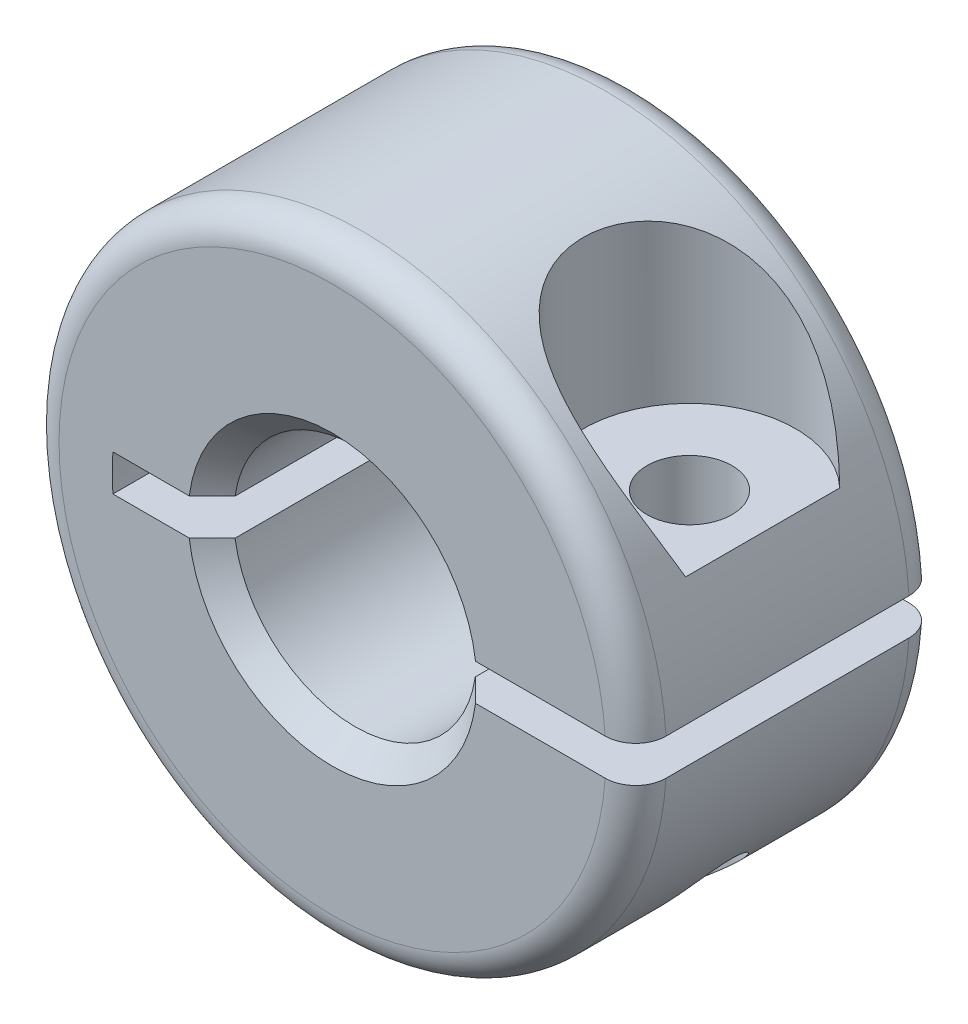
from build123d import *

# Parameters (mm, degrees)
SKICA1_R                 = 10
SKICA1_R_2               = 4
P_IDAT_VYSUNUT_M1_DEPTH  = 10
ODEBRAT_VYSUNUT_M1_DEPTH = 10
SKICA3_R                 = 1.375
ODEBRAT_VYSUNUT_M2_DEPTH = 10
SKICA4_R                 = 1.4
ODEBRAT_VYSUNUT_M3_DEPTH = 10
SKICA5_R                 = 3.5
ODEBRAT_VYSUNUT_M4_DEPTH = 10
ZAOBLIT1_R               = 1
ZKOSEN_2_SIZE            = 0.75


with BuildPart() as part:
    # Skica1 → Přidat vysunutím1 (new body)
    with BuildSketch(Plane.XY):
        Circle(SKICA1_R)
        Circle(SKICA1_R_2, mode=Mode.SUBTRACT)
    extrude(amount=P_IDAT_VYSUNUT_M1_DEPTH)

    # Skica2 → Odebrat vysunutím1 (cut)
    with BuildSketch(Plane.XY.offset(10)):
        with BuildLine():
            Line((-7.225129757, 0.6), (12.11079591, 0.6))
            Line((12.11079591, 0.6), (12.11079591, -0.6))
            Line((12.11079591, -0.6), (-7.225129757, -0.6))
            ThreePointArc((-7.225129757, -0.6), (-7.25, 0), (-7.225129757, 0.6))
        make_face()
    extrude(amount=-ODEBRAT_VYSUNUT_M1_DEPTH, mode=Mode.SUBTRACT)

    # Skica3 → Odebrat vysunutím2 (cut)
    with BuildSketch(Plane(origin=(0, -0.6, 0), x_dir=(1, 0, 0), z_dir=(0, 1, 0))):
        with Locations(Location((6.754743987, -5, 0), (0, 0, 180))):
            Circle(SKICA3_R)
    extrude(amount=-ODEBRAT_VYSUNUT_M2_DEPTH, mode=Mode.SUBTRACT)

    # Skica4 → Odebrat vysunutím3 (cut)
    with BuildSketch(Plane.XZ.offset(-0.6)):
        with Locations((6.754743987, 5)):
            Circle(SKICA4_R)
    extrude(amount=-ODEBRAT_VYSUNUT_M3_DEPTH, mode=Mode.SUBTRACT)

    # Skica5 → Odebrat vysunutím4 (cut)
    with BuildSketch(Plane(origin=(0, 4, 0), x_dir=(1, 0, 0), z_dir=(0, 1, 0))):
        with Locations((6.754743987, -5)):
            Circle(SKICA5_R)
    extrude(amount=ODEBRAT_VYSUNUT_M4_DEPTH, mode=Mode.SUBTRACT)

    # Zaoblit1
    zaoblit1_edges = [part.edges().sort_by_distance(p)[0] for p in [
        (-10, 0, 0),
        (-10, 0, 10),
    ]]
    fillet(zaoblit1_edges, radius=ZAOBLIT1_R)

    # Zkosení2
    zkosen_2_edges = [part.edges().sort_by_distance(p)[0] for p in [
        (0, -4, 10),
        (0, -4, 0),
        (0, 4, 0),
        (0, 4, 10),
    ]]
    chamfer(zkosen_2_edges, length=ZKOSEN_2_SIZE)


solid = part.part
